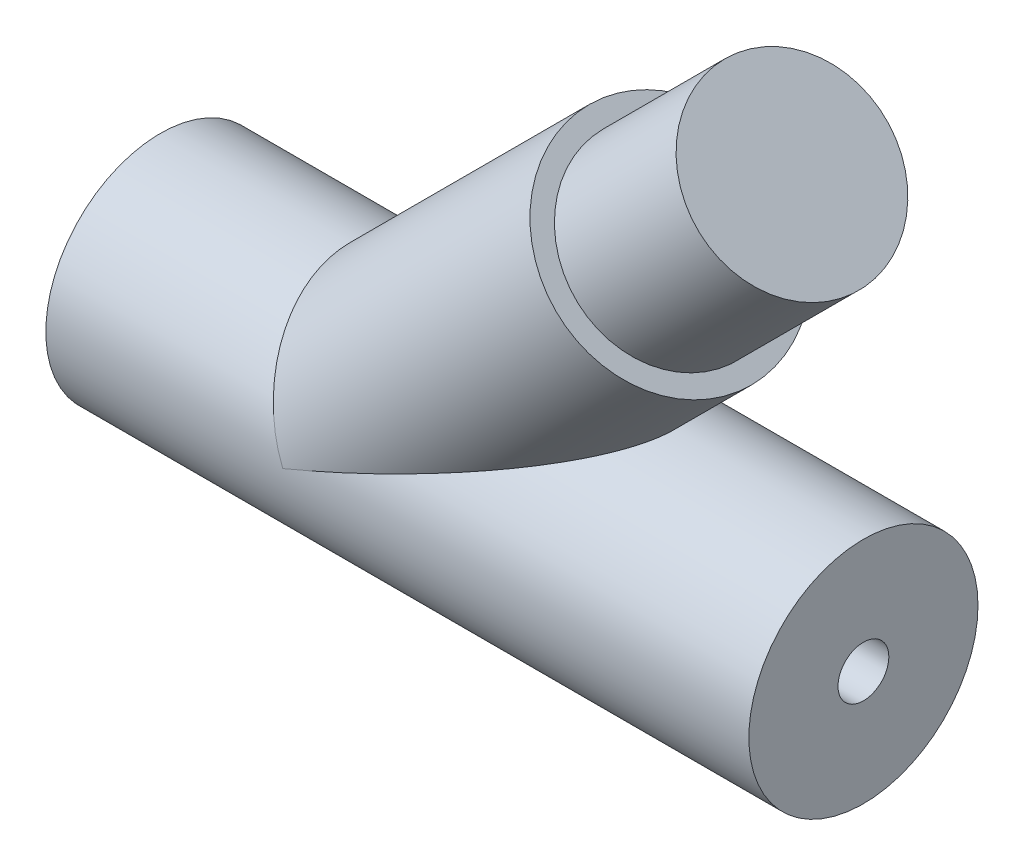
from build123d import *

# Parameters (mm, degrees)
SKETCH1_R           = 28.194
BOSS_EXTRUDE1_DEPTH = 173
SKETCH5_R           = 28.194
BOSS_EXTRUDE3_DEPTH = 95
SKETCH7_R           = 6.25
CUT_EXTRUDE1_DEPTH  = 369.4
SCALE2_SCALE        = 0.6
SKETCH9_R           = 13.97
BOSS_EXTRUDE4_DEPTH = 25.4


with BuildPart() as part:
    # Sketch1 → Boss-Extrude1 (new body)
    with BuildSketch(Plane(origin=(0, 0, 0), x_dir=(0, 0, -1), z_dir=(1, 0, 0))):
        Circle(SKETCH1_R)
    extrude(amount=BOSS_EXTRUDE1_DEPTH)

    # Sketch5 → Boss-Extrude3 (add)
    with BuildSketch(Plane(origin=(29.15, 29.15, 0), x_dir=(0.7071067811865464, -0.7071067811865488, 0), z_dir=(0.7071067811865488, 0.7071067811865464, 0))):
        with Locations(Location((41.224325343, 0, 0), (0, 0, 270))):
            Circle(SKETCH5_R)
    extrude(amount=BOSS_EXTRUDE3_DEPTH)

    # Sketch7 → Cut-Extrude1 (cut)
    with BuildSketch(Plane.ZY):
        Circle(SKETCH7_R)
    extrude(amount=-CUT_EXTRUDE1_DEPTH, mode=Mode.SUBTRACT)


with BuildPart() as part_1:
    # Scale2: scaled about (90.195479619, 12.583516577, 0)
    add(part.part.scale(SCALE2_SCALE).moved(Location((36.078191848, 5.033406631, 0))))

    # Sketch9 → Boss-Extrude4 (add)
    with BuildSketch(Plane(origin=(78.350854573, 78.350854573, 0), x_dir=(0, 0, -1), z_dir=(0.7071067811865487, 0.7071067811865465, 0))):
        with Locations(Location((7.4118e-05, -46.686589237, 0), (0, 0, 90))):
            Circle(SKETCH9_R)
    extrude(amount=BOSS_EXTRUDE4_DEPTH)


solid = part_1.part
